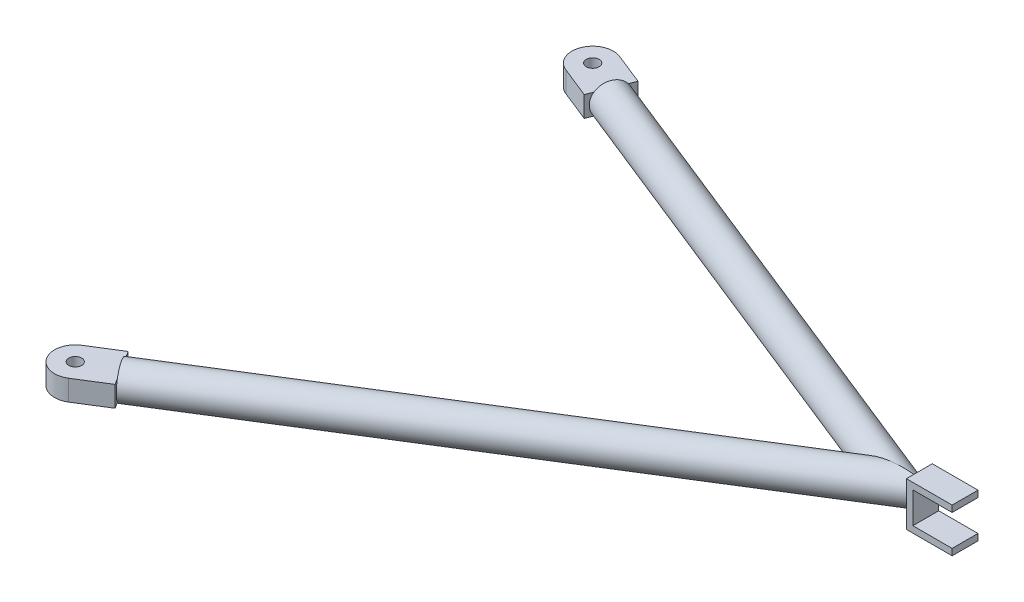
from build123d import *

# Parameters (mm, degrees)
SKETCH2_R                   = 8.255
BOSS_EXTRUDE1_DEPTH         = 6.35
BOSS_EXTRUDE1_DEPTH_BACK    = 6.35
BOSS_EXTRUDE2_DEPTH         = 10.16
BOSS_EXTRUDE2_DEPTH_BACK    = 16.51
SKETCH4_W                   = 20.32
SKETCH4_H                   = 10.16
BOSS_EXTRUDE3_DEPTH         = 10.16
BOSS_EXTRUDE3_DEPTH_BACK    = 16.256
SKETCH5_W                   = 20.32
SKETCH5_H                   = 10.16
CUT_EXTRUDE1_DEPTH          = 312.833197041
CUT_EXTRUDE2_DEPTH          = 312.833197041
CUT_EXTRUDE3_DEPTH          = 16.51
CUT_EXTRUDE4_START          = -16.256
CUT_EXTRUDE4_DEPTH          = 16.256
CUT_EXTRUDE5_DEPTH          = 303.933951477
E_0_25_DIAMETER_HOLE1_D     = 6.35
E_0_25_DIAMETER_HOLE1_DEPTH = 19.05
E_0_25_DIAMETER_HOLE1_TIP   = 1.907732465


with BuildPart() as part:
    # Sweep1: sweep along a path in Sketch1
    with BuildLine(Plane(origin=(0, 0, 0), x_dir=(1, 0, 0), z_dir=(0, 1, 0))) as sweep1_path:
        Line((-247.620690573, 99.06), (0, 0))
        Line((0, 0), (-247.620690573, -154.94))
    # Sketch2 → Sweep1 (sweep)
    with BuildSketch(Plane(origin=(-247.620690573, 0, 154.94), x_dir=(0.5304347826086957, 0, 0.847725746570709), z_dir=(-0.8477257465707089, 0, 0.5304347826086956))):
        Circle(SKETCH2_R)
    sweep(path=sweep1_path.line, transition=Transition.RIGHT)

    # Sketch3 → Boss-Extrude1 (add, two sides: drawn at the far end of the back side and taken through both)
    with BuildSketch(Plane.XY.offset(-BOSS_EXTRUDE1_DEPTH_BACK)):
        Polygon((34.256672931, -10.795), (11.811, -10.795), (11.811, 10.795), (34.256672931, 10.795), (34.256672931, 7.62), (14.986, 7.62), (14.986, -7.62), (34.256672931, -7.62), align=None)
    extrude(amount=BOSS_EXTRUDE1_DEPTH + BOSS_EXTRUDE1_DEPTH_BACK)

    # Sketch4 → Boss-Extrude2 (add, two sides: drawn at the far end of the back side and taken through both)
    with BuildSketch(Plane(origin=(-247.620690573, 0, 154.94), x_dir=(0.5304347826086958, 0, 0.8477257465707089), z_dir=(-0.847725746570709, 0, 0.5304347826086958)).offset(-BOSS_EXTRUDE2_DEPTH_BACK)):
        Rectangle(SKETCH4_W, SKETCH4_H)
    extrude(amount=BOSS_EXTRUDE2_DEPTH + BOSS_EXTRUDE2_DEPTH_BACK)

    # Sketch5 → Boss-Extrude3 (add, two sides: drawn at the far end of the back side and taken through both)
    with BuildSketch(Plane(origin=(-247.620690573, 0, -99.06), x_dir=(-0.3714285714285716, 0, 0.9284615319583954), z_dir=(-0.9284615319583954, 0, -0.3714285714285716)).offset(-BOSS_EXTRUDE3_DEPTH_BACK)):
        Rectangle(SKETCH5_W, SKETCH5_H)
    extrude(amount=BOSS_EXTRUDE3_DEPTH + BOSS_EXTRUDE3_DEPTH_BACK)

    # Sketch7 → Cut-Extrude1 (cut, through all)
    with BuildSketch(Plane(origin=(0, 5.08, 0), x_dir=(1, 0, 0), z_dir=(0, 1, 0))):
        with BuildLine():
            Line((-257.053859738, 102.833714286), (-260.827574024, 93.400545121))
            Line((-260.827574024, 93.400545121), (-251.394404859, 89.626830835))
            ThreePointArc((-251.394404859, 89.626830835), (-256.959367419, 95.058161077), (-257.053859738, 102.833714286))
        make_face()
    cut_extrude1 = extrude(amount=-CUT_EXTRUDE1_DEPTH, mode=Mode.SUBTRACT)

    # Mirror1: Cut-Extrude1 across plane
    add(cut_extrude1.mirror(Plane(origin=(0, 0, 0), x_dir=(0.9284615319583953, 0, 0.3714285714285718), z_dir=(-0.3714285714285718, 0, 0.9284615319583954))), mode=Mode.SUBTRACT)

    # Sketch9 → Cut-Extrude2 (cut, through all)
    with BuildSketch(Plane(origin=(0, 5.08, 0), x_dir=(1, 0, 0), z_dir=(0, 1, 0))):
        with BuildLine():
            Line((-242.231473182, -163.552893585), (-250.844366767, -168.942110976))
            Line((-250.844366767, -168.942110976), (-256.233584158, -160.329217391))
            ThreePointArc((-256.233584158, -160.329217391), (-249.90017387, -164.840987622), (-242.231473182, -163.552893585))
        make_face()
    cut_extrude2 = extrude(amount=-CUT_EXTRUDE2_DEPTH, mode=Mode.SUBTRACT)

    # Mirror2: Cut-Extrude2 across plane
    add(cut_extrude2.mirror(Plane(origin=(0, 0, 0), x_dir=(-0.8477257465707089, 0, 0.5304347826086955), z_dir=(0.5304347826086959, 0, 0.8477257465707089))), mode=Mode.SUBTRACT)

    # Sketch10 → Cut-Extrude3 (cut)
    with BuildSketch(Plane(origin=(-247.620690573, 0, 154.94), x_dir=(0.5304347826086958, 0, 0.8477257465707089), z_dir=(-0.847725746570709, 0, 0.5304347826086958))):
        with BuildLine():
            Line((6.506813736, -5.08), (-6.506813736, -5.08))
            ThreePointArc((-6.506813736, -5.08), (0, -8.255), (6.506813736, -5.08))
        make_face()
        with BuildLine():
            Line((-6.506813736, 5.08), (6.506813736, 5.08))
            ThreePointArc((6.506813736, 5.08), (0, 8.255), (-6.506813736, 5.08))
        make_face()
    extrude(amount=-CUT_EXTRUDE3_DEPTH, mode=Mode.SUBTRACT)

    # Sketch11 → Cut-Extrude4 (cut)
    with BuildSketch(Plane(origin=(-247.620690573, 0, -99.06), x_dir=(-0.3714285714285716, 0, 0.9284615319583954), z_dir=(-0.9284615319583954, 0, -0.3714285714285716)).offset(CUT_EXTRUDE4_START)):
        with BuildLine():
            Line((6.506813736, -5.08), (-6.506813736, -5.08))
            ThreePointArc((-6.506813736, -5.08), (0, -8.255), (6.506813736, -5.08))
        make_face()
        with BuildLine():
            Line((-6.506813736, 5.08), (6.506813736, 5.08))
            ThreePointArc((6.506813736, 5.08), (0, 8.255), (-6.506813736, 5.08))
        make_face()
    extrude(amount=CUT_EXTRUDE4_DEPTH, mode=Mode.SUBTRACT)

    # Sketch12 → Cut-Extrude5 (cut, through all)
    with BuildSketch(Plane.XY.offset(6.35)):
        with BuildLine():
            Line((14.986, 4.663063163), (14.986, -4.663063163))
            add(Edge.make_bspline(
                [(14.986, -4.663063163), (22.008669492, 0), (14.986, 4.663063163)],
                knots=[5.682900603, 5.682900603, 5.682900603, 6.883470012, 6.883470012, 6.883470012], degree=2, weights=[1, 0.825174825, 1]))
        make_face()
    extrude(amount=-CUT_EXTRUDE5_DEPTH, mode=Mode.SUBTRACT)

    # E (0.25) Diameter Hole1
    with Locations(Plane(origin=(-247.620690573, 5.08, -99.06), x_dir=(0, 0, 1), z_dir=(0, 1, 0))):
        with Locations((0, 0), (254, 0)):
            Hole(E_0_25_DIAMETER_HOLE1_D / 2, depth=E_0_25_DIAMETER_HOLE1_DEPTH)
            with Locations((0, 0, -(E_0_25_DIAMETER_HOLE1_DEPTH + E_0_25_DIAMETER_HOLE1_TIP / 2))):  # 118° drill point
                Cone(0, E_0_25_DIAMETER_HOLE1_D / 2, E_0_25_DIAMETER_HOLE1_TIP, mode=Mode.SUBTRACT)


solid = part.part
